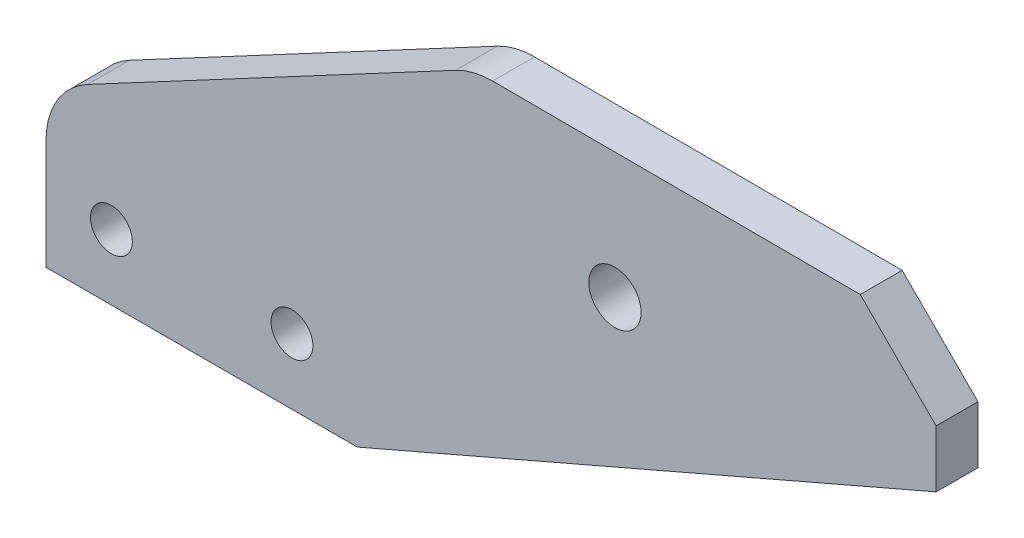
from build123d import *

# Parameters (mm, degrees)
SKETCH1_R           = 2.032
SKETCH1_R_2         = 2.54
BOSS_EXTRUDE1_DEPTH = 4.064


with BuildPart() as part:
    # Sketch1 → Boss-Extrude1 (new body)
    with BuildSketch(Plane.XY):
        with BuildLine():
            Line((0, 0), (0, 10.667831766))
            ThreePointArc((0, 10.667831766), (1.08596755, 14.588395494), (4.034335943, 17.391477598))
            Line((4.034335943, 17.391477598), (39.755950307, 36.44151561))
            ThreePointArc((39.755950307, 36.44151561), (41.504009214, 37.112976763), (43.363043022, 37.337839648))
            Line((43.363043022, 37.337839648), (79.046414123, 37.237491906))
            Line((79.046414123, 37.237491906), (86.410224142, 29.873681887))
            Line((86.410224142, 29.873681887), (86.410224142, 24.325303591))
            Line((86.410224142, 24.325303591), (30.226, 0))
            Line((30.226, 0), (0, 0))
        make_face()
        with Locations((6.35, 6.35)):
            Circle(SKETCH1_R, mode=Mode.SUBTRACT)
        with Locations((23.876, 6.35)):
            Circle(SKETCH1_R, mode=Mode.SUBTRACT)
        with Locations((55.230593188, 25.086083138)):
            Circle(SKETCH1_R_2, mode=Mode.SUBTRACT)
    extrude(amount=BOSS_EXTRUDE1_DEPTH)


solid = part.part
